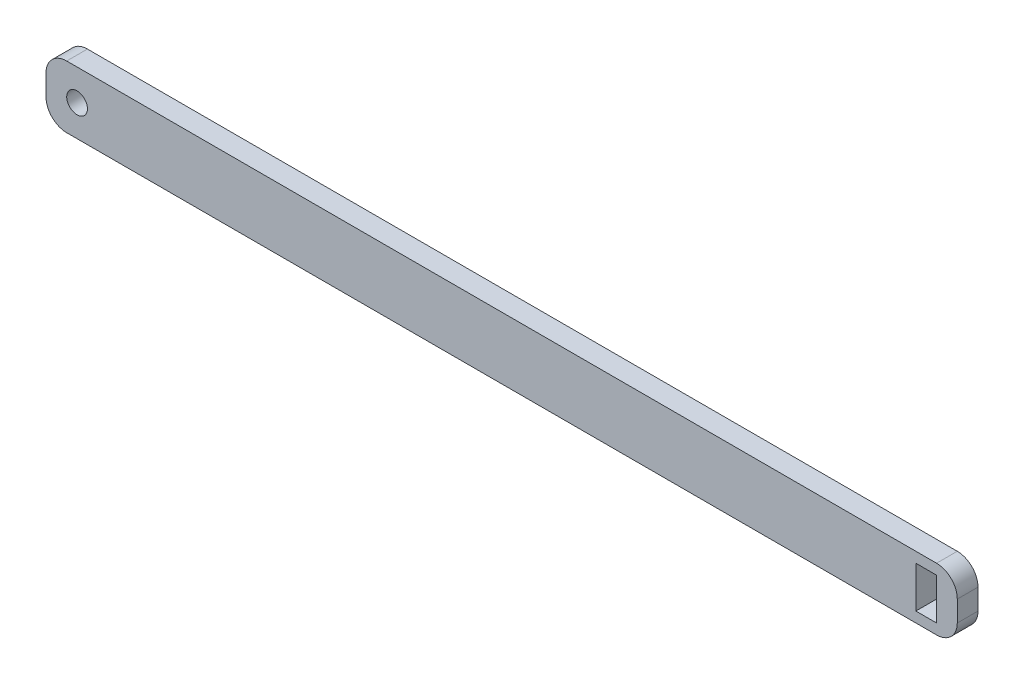
from build123d import *

# Parameters (mm, degrees)
SKETCH1_R           = 2.5
SKETCH1_W           = 5
SKETCH1_H           = 10
BOSS_EXTRUDE1_DEPTH = 5


with BuildPart() as part:
    # Sketch1 → Boss-Extrude1 (new body)
    with BuildSketch(Plane.XY):
        with BuildLine():
            Line((-215, 15), (-5, 15))
            ThreePointArc((-5, 15), (-1.464466094, 13.535533906), (0, 10))
            Line((0, 10), (0, 5))
            ThreePointArc((0, 5), (-1.464466094, 1.464466094), (-5, 0))
            Line((-5, 0), (-215, 0))
            ThreePointArc((-215, 0), (-218.535533906, 1.464466094), (-220, 5))
            Line((-220, 5), (-220, 10))
            ThreePointArc((-220, 10), (-218.535533906, 13.535533906), (-215, 15))
        make_face()
        with Locations((-212.5, 7.5)):
            Circle(SKETCH1_R, mode=Mode.SUBTRACT)
        with Locations((-7.5, 7.5)):
            Rectangle(SKETCH1_W, SKETCH1_H, mode=Mode.SUBTRACT)
    extrude(amount=BOSS_EXTRUDE1_DEPTH)


solid = part.part
